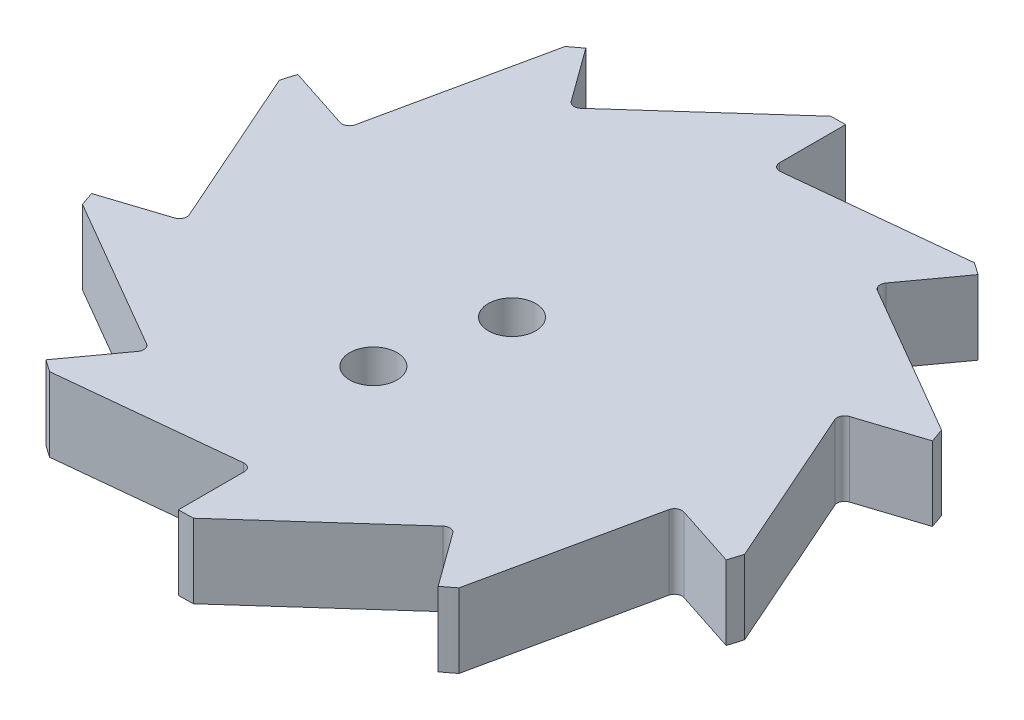
from build123d import *

# Parameters (mm, degrees)
SKETCH2_R           = 3.2
BOSS_EXTRUDE1_DEPTH = 10
FILLET1_R           = 1
SKETCH3_R           = 3.2
CUT_EXTRUDE1_DEPTH  = 40


with BuildPart() as part:
    # Sketch2 → Boss-Extrude1 (new body)
    with BuildSketch(Plane(origin=(0, 0, 0), x_dir=(1, 0, 0), z_dir=(0, 1, 0))):
        with BuildLine():
            Line((-2, 44.955533586), (-20.57248383, 28.315594803))
            Line((-20.57248383, 28.315594803), (-26.450336353, 36.405764747))
            ThreePointArc((-26.450336353, 36.405764747), (-27.253018295, 35.808839605), (-28.04223364, 35.194220158))
            Line((-28.04223364, 35.194220158), (-33.28697807, 10.815594803))
            Line((-33.28697807, 10.815594803), (-42.797543233, 13.905764747))
            ThreePointArc((-42.797543233, 13.905764747), (-43.09606277, 12.951037555), (-43.373287149, 11.989910837))
            Line((-43.373287149, 11.989910837), (-33.28697807, -10.815594803))
            Line((-33.28697807, -10.815594803), (-42.797543233, -13.905764747))
            ThreePointArc((-42.797543233, -13.905764747), (-42.477876048, -14.853620651), (-42.137219172, -15.794136902))
            Line((-42.137219172, -15.794136902), (-20.57248383, -28.315594803))
            Line((-20.57248383, -28.315594803), (-26.450336353, -36.405764747))
            ThreePointArc((-26.450336353, -36.405764747), (-25.634584446, -36.984700625), (-24.806165662, -37.545361167))
            Line((-24.806165662, -37.545361167), (0, -35))
            Line((0, -35), (0, -45))
            ThreePointArc((0, -45), (1.000247127, -44.988882023), (2, -44.955533586))
            Line((2, -44.955533586), (20.57248383, -28.315594803))
            Line((20.57248383, -28.315594803), (26.450336353, -36.405764747))
            ThreePointArc((26.450336353, -36.405764747), (27.253018295, -35.808839605), (28.04223364, -35.194220158))
            Line((28.04223364, -35.194220158), (33.28697807, -10.815594803))
            Line((33.28697807, -10.815594803), (42.797543233, -13.905764747))
            ThreePointArc((42.797543233, -13.905764747), (43.09606277, -12.951037555), (43.373287149, -11.989910837))
            Line((43.373287149, -11.989910837), (33.28697807, 10.815594803))
            Line((33.28697807, 10.815594803), (42.797543233, 13.905764747))
            ThreePointArc((42.797543233, 13.905764747), (42.477876048, 14.853620651), (42.137219172, 15.794136902))
            Line((42.137219172, 15.794136902), (20.57248383, 28.315594803))
            Line((20.57248383, 28.315594803), (26.450336353, 36.405764747))
            ThreePointArc((26.450336353, 36.405764747), (25.634584446, 36.984700625), (24.806165662, 37.545361167))
            Line((24.806165662, 37.545361167), (0, 35))
            Line((0, 35), (0, 45))
            ThreePointArc((0, 45), (-1.000247127, 44.988882023), (-2, 44.955533586))
        make_face()
        with Locations(Location((0, 0, 0), (0, 0, 270))):
            Circle(SKETCH2_R, mode=Mode.SUBTRACT)
    extrude(amount=BOSS_EXTRUDE1_DEPTH)

    # Fillet1
    fillet1_edges = [part.edges().sort_by_distance(p)[0] for p in [
        (-20.57248383, 5, 28.315594803),
        (-33.28697807, 5, 10.815594803),
        (-33.28697807, 5, -10.815594803),
        (-20.57248383, 5, -28.315594803),
        (0, 5, -35),
        (20.57248383, 5, -28.315594803),
        (33.28697807, 5, -10.815594803),
        (33.28697807, 5, 10.815594803),
        (20.57248383, 5, 28.315594803),
        (0, 5, 35),
    ]]
    fillet(fillet1_edges, radius=FILLET1_R)

    # Sketch3 → Cut-Extrude1 (cut)
    with BuildSketch(Plane(origin=(352.77049505, 10, -1092.526706597), x_dir=(-0.9455896889977465, 0, 0.32536155283183854), z_dir=(0, 1, 0))):
        with Locations(Location((697.366992794, 931.392438652, 0), (0, 0, 71.012519009))):
            Circle(SKETCH3_R)
    extrude(amount=-CUT_EXTRUDE1_DEPTH, mode=Mode.SUBTRACT)


solid = part.part
